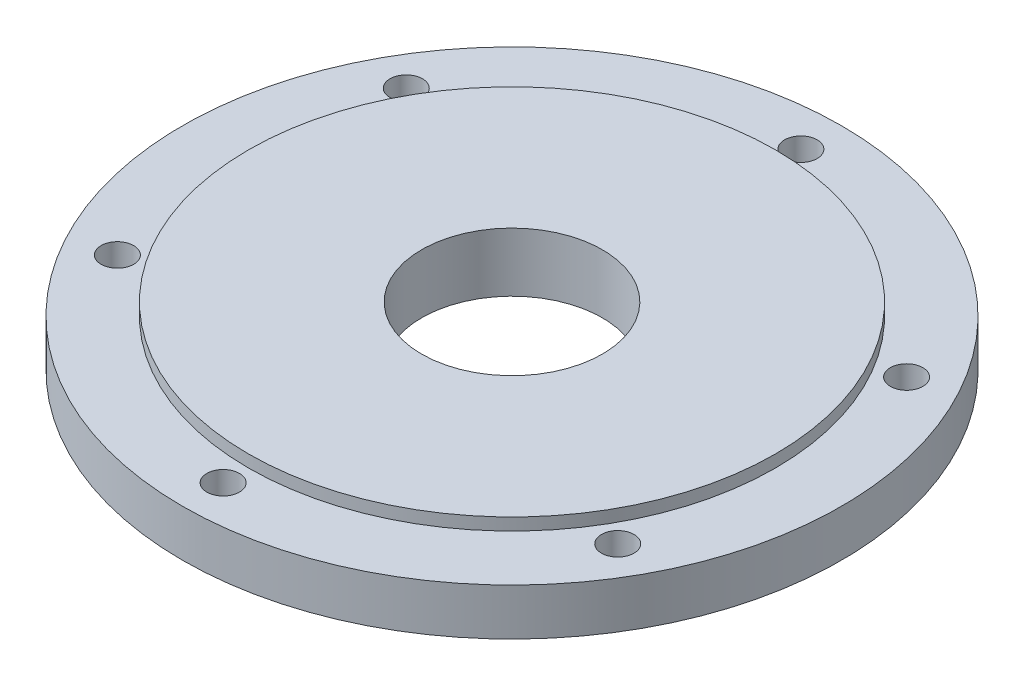
from build123d import *

# Parameters (mm, degrees)
SKETCH1_R           = 81
SKETCH1_R_2         = 22.225
SKETCH1_R_3         = 4
BOSS_EXTRUDE1_DEPTH = 14.5
SKETCH2_R           = 87.498812031
SKETCH2_R_2         = 64.75
CUT_EXTRUDE1_DEPTH  = 3


with BuildPart() as part:
    # Sketch1 → Boss-Extrude1 (new body)
    with BuildSketch(Plane(origin=(0, 0, 0), x_dir=(1, 0, 0), z_dir=(0, 1, 0))):
        with Locations(Location((0, 0, 0), (0, 0, 270))):
            Circle(SKETCH1_R)
        with Locations(Location((0, 0, 0), (0, 0, 270))):
            Circle(SKETCH1_R_2, mode=Mode.SUBTRACT)
        with Locations(Location((0, 71, 0), (0, 0, 270))):
            Circle(SKETCH1_R_3, mode=Mode.SUBTRACT)
        with Locations(Location((61.487803669, 35.5, 0), (0, 0, 270))):
            Circle(SKETCH1_R_3, mode=Mode.SUBTRACT)
        with Locations(Location((61.487803669, -35.5, 0), (0, 0, 270))):
            Circle(SKETCH1_R_3, mode=Mode.SUBTRACT)
        with Locations(Location((0, -71, 0), (0, 0, 270))):
            Circle(SKETCH1_R_3, mode=Mode.SUBTRACT)
        with Locations(Location((-61.487803669, -35.5, 0), (0, 0, 270))):
            Circle(SKETCH1_R_3, mode=Mode.SUBTRACT)
        with Locations(Location((-61.487803669, 35.5, 0), (0, 0, 270))):
            Circle(SKETCH1_R_3, mode=Mode.SUBTRACT)
    extrude(amount=-BOSS_EXTRUDE1_DEPTH)

    # Sketch2 → Cut-Extrude1 (cut)
    with BuildSketch(Plane(origin=(0, 0, 0), x_dir=(1, 0, 0), z_dir=(0, 1, 0))):
        Circle(SKETCH2_R)
        with Locations(Location((0, 0, 0), (0, 0, 270))):
            Circle(SKETCH2_R_2, mode=Mode.SUBTRACT)
    extrude(amount=-CUT_EXTRUDE1_DEPTH, mode=Mode.SUBTRACT)


solid = part.part
